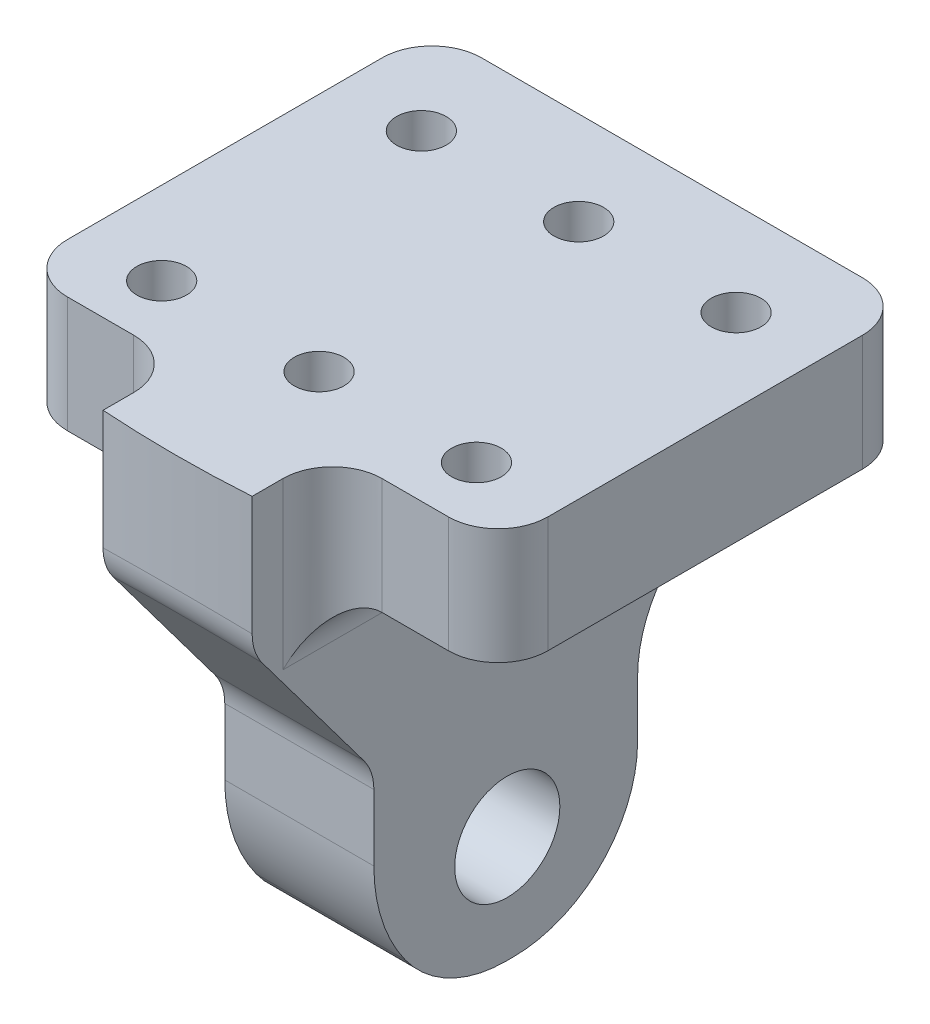
from build123d import *

# Parameters (mm, degrees)
BOSS_EXTRUDE1_DEPTH = 33
SKETCH2_R           = 3.175
CUT_EXTRUDE1_DEPTH  = 20
CUT_EXTRUDE2_DEPTH  = 20
FILLET1_R           = 10
SKETCH3_R           = 1.5
CUT_EXTRUDE3_DEPTH  = 7
SKETCH3_3_R         = 1.5
CUT_EXTRUDE4_DEPTH  = 7
SKETCH3_4_W         = 10
SKETCH3_4_H         = 24.9977367
BOSS_EXTRUDE2_DEPTH = 10
SKETCH3_5_R         = 1.5
CUT_EXTRUDE5_DEPTH  = 8
FILLET9_R           = 3
SKETCH20_W          = 10
SKETCH20_H          = 3
CUT_EXTRUDE6_DEPTH  = 25
FILLET10_R          = 3
FILLET11_R          = 10
FILLET12_R          = 3
FILLET13_R          = 3
CUT_EXTRUDE7_DEPTH  = 5
FILLET17_R          = 7.5
FILLET18_R          = 7.5
FILLET19_R          = 7.5


with BuildPart() as part:
    # Sketch1 → Boss-Extrude1 (new body)
    with BuildSketch(Plane(origin=(0, 0, 0), x_dir=(1, 0, 0), z_dir=(0, 1, 0))):
        with BuildLine():
            ThreePointArc((-4.5, 0.152430338), (0, 0), (4.5, 0.152430338))
            Line((4.5, 0.152430338), (4.5, 30))
            Line((4.5, 30), (-4.5, 30))
            Line((-4.5, 30), (-4.5, 0.152430338))
        make_face()
    extrude(amount=-BOSS_EXTRUDE1_DEPTH)

    # Sketch2 → Cut-Extrude1 (cut)
    with BuildSketch(Plane(origin=(4.5, 0, 0), x_dir=(0, 0, -1), z_dir=(1, 0, 0))):
        with Locations((15.552430338, -25.5)):
            Circle(SKETCH2_R)
    extrude(amount=-CUT_EXTRUDE1_DEPTH, mode=Mode.SUBTRACT)

    # Sketch2<4> → Cut-Extrude2 (cut)
    with BuildSketch(Plane(origin=(4.5, 0, 0), x_dir=(0, 0, -1), z_dir=(1, 0, 0))):
        Polygon((7.5, -33), (7.5, -18), (0, -8), (0, -33), align=None)
    extrude(amount=-CUT_EXTRUDE2_DEPTH, mode=Mode.SUBTRACT)

    # Fillet1
    fillet1_edges = [part.edges().sort_by_distance(p)[0] for p in [
        (0, -33, -7.5),
    ]]
    fillet(fillet1_edges, radius=FILLET1_R)

    # Sketch3 → Cut-Extrude3 (cut)
    with BuildSketch(Plane(origin=(0, 0, 0), x_dir=(1, 0, 0), z_dir=(0, 1, 0))):
        with Locations((0, 24.36613165)):
            Circle(SKETCH3_R)
    extrude(amount=-CUT_EXTRUDE3_DEPTH, mode=Mode.SUBTRACT)

    # Sketch3<3> → Cut-Extrude4 (cut)
    with BuildSketch(Plane(origin=(0, 0, 0), x_dir=(1, 0, 0), z_dir=(0, 1, 0))):
        with Locations((0, 8.6922633)):
            Circle(SKETCH3_3_R)
    extrude(amount=-CUT_EXTRUDE4_DEPTH, mode=Mode.SUBTRACT)

    # Sketch3<4> → Boss-Extrude2 (add)
    with BuildSketch(Plane(origin=(0, 0, 0), x_dir=(1, 0, 0), z_dir=(0, 1, 0))):
        with Locations((9.5, 17.50113165)):
            Rectangle(SKETCH3_4_W, SKETCH3_4_H)
        with Locations((-9.5, 17.50113165)):
            Rectangle(SKETCH3_4_W, SKETCH3_4_H)
    extrude(amount=-BOSS_EXTRUDE2_DEPTH)

    # Sketch3<5> → Cut-Extrude5 (cut)
    with BuildSketch(Plane(origin=(0, 0, 0), x_dir=(1, 0, 0), z_dir=(0, 1, 0))):
        with Locations((-9.5, 24.36613165)):
            Circle(SKETCH3_5_R)
        with Locations((-9.5, 8.6922633)):
            Circle(SKETCH3_5_R)
        with Locations((9.5, 8.6922633)):
            Circle(SKETCH3_5_R)
        with Locations((9.5, 24.36613165)):
            Circle(SKETCH3_5_R)
    extrude(amount=-CUT_EXTRUDE5_DEPTH, mode=Mode.SUBTRACT)

    # Fillet9
    fillet9_edges = [part.edges().sort_by_distance(p)[0] for p in [
        (0, -18, -7.5),
        (-2.253575518, -8.050927935, -0.038195951),
    ]]
    fillet(fillet9_edges, radius=FILLET9_R)

    # Sketch20 → Cut-Extrude6 (cut)
    with BuildSketch(Plane.XY.offset(-5.0022633)):
        with Locations((-9.5, -8.5)):
            Rectangle(SKETCH20_W, SKETCH20_H)
        with Locations((9.5, -8.5)):
            Rectangle(SKETCH20_W, SKETCH20_H)
    extrude(amount=-CUT_EXTRUDE6_DEPTH, mode=Mode.SUBTRACT)

    # Fillet10
    fillet10_edges = [part.edges().sort_by_distance(p)[0] for p in [
        (4.5, -3.5, -5.0022633),
        (-4.5, -3.5, -5.0022633),
    ]]
    fillet(fillet10_edges, radius=FILLET10_R)

    # Fillet11
    fillet11_edges = [part.edges().sort_by_distance(p)[0] for p in [
        (0, -33, -30),
    ]]
    fillet(fillet11_edges, radius=FILLET11_R)

    # Fillet12
    fillet12_edges = [part.edges().sort_by_distance(p)[0] for p in [
        (14.5, -3.5, -30),
        (14.5, -3.5, -5.0022633),
        (-14.5, -3.5, -30),
        (-14.5, -3.5, -5.0022633),
    ]]
    fillet(fillet12_edges, radius=FILLET12_R)

    # Fillet13
    fillet13_edges = [part.edges().sort_by_distance(p)[0] for p in [
        (4.5, -7, -16.00113165),
        (-4.5, -7, -16.00113165),
    ]]
    fillet(fillet13_edges, radius=FILLET13_R)

    # Sketch21 → Cut-Extrude7 (cut, symmetric)
    with BuildSketch(Plane(origin=(0, 0, 0), x_dir=(0, 0, -1), z_dir=(1, 0, 0))):
        Polygon((31.193881394, -10), (30, -10), (23.419344423, -18.511746958), (23.419344423, -31.964785254), (7.776068465, -31.964785254), (7.488922124, -35.386612487), (23.419344423, -35.386612487), (23.419344423, -32.39723809), (31.193881394, -32.39723809), align=None)
    extrude(amount=CUT_EXTRUDE7_DEPTH, both=True, mode=Mode.SUBTRACT)

    # Fillet17
    fillet17_edges = [part.edges().sort_by_distance(p)[0] for p in [
        (0, -31.964785254, -23.419344423),
    ]]
    fillet(fillet17_edges, radius=FILLET17_R)

    # Fillet18
    fillet18_edges = [part.edges().sort_by_distance(p)[0] for p in [
        (0, -31.964785254, -13.069128149),
    ]]
    fillet(fillet18_edges, radius=FILLET18_R)

    # Fillet19
    fillet19_edges = [part.edges().sort_by_distance(p)[0] for p in [
        (0, -10, -30),
        (0, -18.511746958, -23.419344423),
    ]]
    fillet(fillet19_edges, radius=FILLET19_R)


solid = part.part
